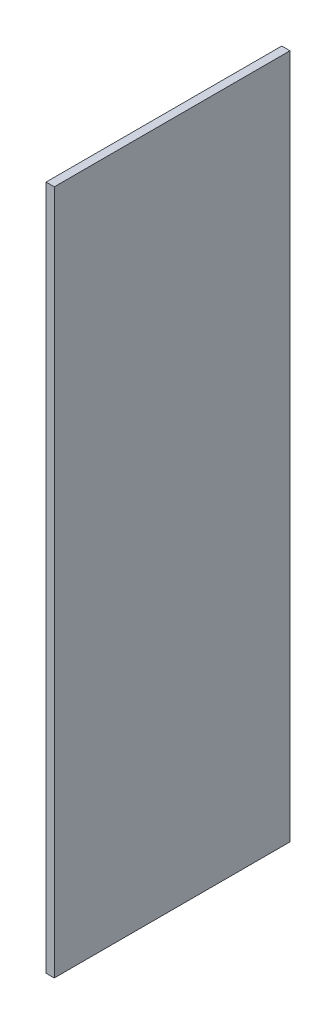
from build123d import *

# Parameters (mm, degrees)
SKETCH_1_W      = 86
SKETCH_1_H      = 250
EXTRUDE_1_DEPTH = 3


with BuildPart() as part:
    # 스케치1 → 보스-돌출1 (new body)
    with BuildSketch(Plane(origin=(0, 0, 0), x_dir=(0, 0, -1), z_dir=(1, 0, 0))):
        with Locations((43, 125)):
            Rectangle(SKETCH_1_W, SKETCH_1_H)
    extrude(amount=EXTRUDE_1_DEPTH)


solid = part.part
